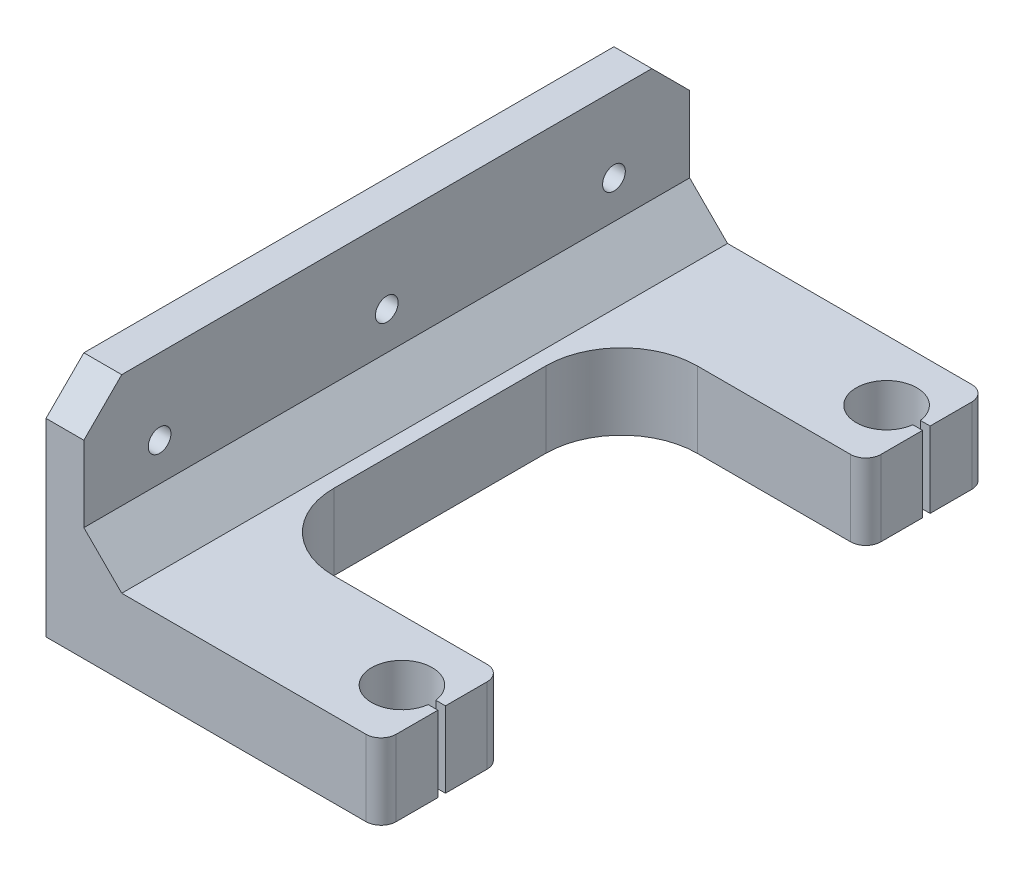
from build123d import *

# Parameters (mm, degrees)
SKETCH1_R           = 4
BOSS_EXTRUDE1_DEPTH = 10
SKETCH2_W           = 5
SKETCH2_H           = 80
BOSS_EXTRUDE2_DEPTH = 20
BOSS_EXTRUDE3_START = -10
SKETCH5_R           = 4
BOSS_EXTRUDE3_DEPTH = 2
SKETCH3_R           = 1.5
CUT_EXTRUDE1_DEPTH  = 95.024265485
CUT_EXTRUDE2_DEPTH  = 94.584520622
CHAMFER2_SIZE       = 5
FILLET1_R           = 2
FILLET2_R           = 10
CHAMFER1_SIZE       = 5


with BuildPart() as part:
    # Sketch1 → Boss-Extrude1 (new body)
    with BuildSketch(Plane(origin=(0, 0, 0), x_dir=(1, 0, 0), z_dir=(0, 1, 0))):
        Polygon((0, 0), (0, -80), (44.25, -80), (44.25, -64), (12, -64), (12, -16), (44.25, -16), (44.25, 0), align=None)
        with Locations(Location((39, -8, 0), (0, 0, 270))):
            Circle(SKETCH1_R, mode=Mode.SUBTRACT)
        with Locations(Location((39, -72, 0), (0, 0, 90))):
            Circle(SKETCH1_R, mode=Mode.SUBTRACT)
    extrude(amount=BOSS_EXTRUDE1_DEPTH)

    # Sketch2 → Boss-Extrude2 (add)
    with BuildSketch(Plane(origin=(0, 10, 0), x_dir=(1, 0, 0), z_dir=(0, 1, 0))):
        with Locations((2.5, -40)):
            Rectangle(SKETCH2_W, SKETCH2_H)
    extrude(amount=BOSS_EXTRUDE2_DEPTH)

    # Sketch5 → Boss-Extrude3 (add)
    with BuildSketch(Plane(origin=(0, 10, 0), x_dir=(1, 0, 0), z_dir=(0, 1, 0)).offset(BOSS_EXTRUDE3_START)):
        with Locations(Location((39, -72, 0), (0, 0, 90))):
            Circle(SKETCH5_R)
        with Locations(Location((39, -8, 0), (0, 0, 270))):
            Circle(SKETCH5_R)
    extrude(amount=BOSS_EXTRUDE3_DEPTH)

    # Sketch3 → Cut-Extrude1 (cut, through all)
    with BuildSketch(Plane(origin=(5, 0, 0), x_dir=(0, 0, -1), z_dir=(1, 0, 0))):
        with Locations((-70, 20)):
            Circle(SKETCH3_R)
        with Locations((-40, 20)):
            Circle(SKETCH3_R)
        with Locations((-10, 20)):
            Circle(SKETCH3_R)
    extrude(amount=-CUT_EXTRUDE1_DEPTH, mode=Mode.SUBTRACT)

    # Sketch4 → Cut-Extrude2 (cut, through all)
    with BuildSketch(Plane(origin=(0, 10, 0), x_dir=(1, 0, 0), z_dir=(0, 1, 0))):
        with BuildLine():
            Line((39, -7.5), (44.25, -7.5))
            ThreePointArc((44.25, -7.5), (44.75, -8), (44.25, -8.5))
            Line((44.25, -8.5), (39, -8.5))
            ThreePointArc((39, -8.5), (38.5, -8), (39, -7.5))
        make_face()
        with BuildLine():
            Line((39, -71.5), (44.25, -71.5))
            ThreePointArc((44.25, -71.5), (44.75, -72), (44.25, -72.5))
            Line((44.25, -72.5), (39, -72.5))
            ThreePointArc((39, -72.5), (38.5, -72), (39, -71.5))
        make_face()
    extrude(amount=-CUT_EXTRUDE2_DEPTH, mode=Mode.SUBTRACT)

    # Chamfer2
    chamfer2_edges = [part.edges().sort_by_distance(p)[0] for p in [
        (5, 10, 40),
    ]]
    chamfer(chamfer2_edges, length=CHAMFER2_SIZE)

    # Fillet1
    fillet1_edges = [part.edges().sort_by_distance(p)[0] for p in [
        (44.25, 5, 0),
        (44.25, 5, 16),
        (44.25, 5, 64),
        (44.25, 5, 80),
    ]]
    fillet(fillet1_edges, radius=FILLET1_R)

    # Fillet2
    fillet2_edges = [part.edges().sort_by_distance(p)[0] for p in [
        (12, 5, 16),
        (12, 5, 64),
    ]]
    fillet(fillet2_edges, radius=FILLET2_R)

    # Chamfer1
    chamfer1_edges = [part.edges().sort_by_distance(p)[0] for p in [
        (2.5, 30, 80),
        (2.5, 30, 0),
    ]]
    chamfer(chamfer1_edges, length=CHAMFER1_SIZE)


solid = part.part
